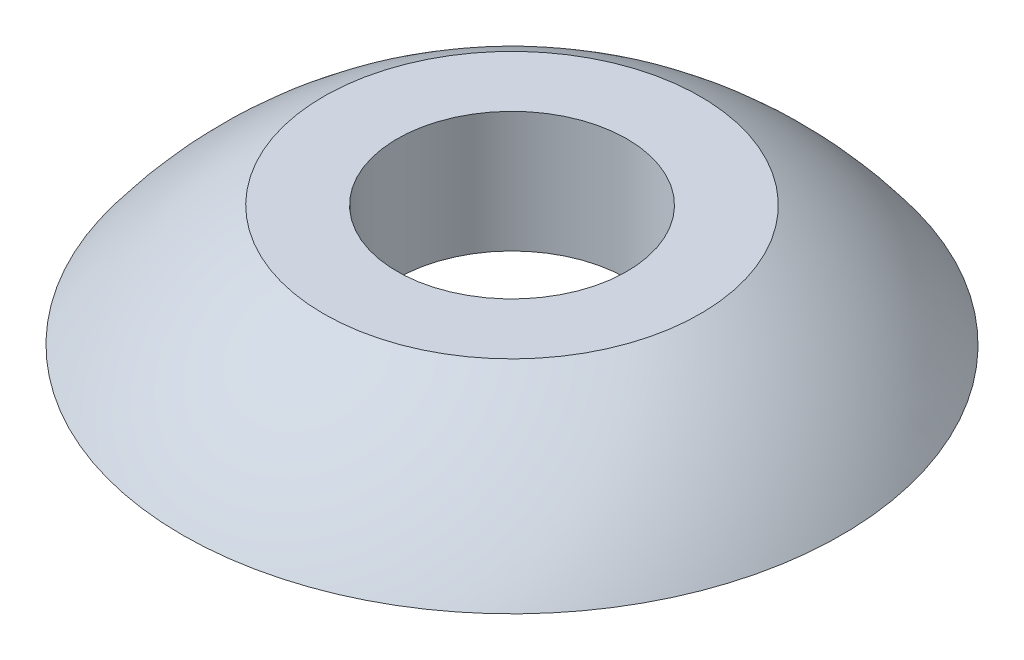
from build123d import *


with BuildPart() as part:
    # Sketch2 → Revolve1 (revolve)
    with BuildSketch(Plane(origin=(0, 0, 0), x_dir=(0, 0, -1), z_dir=(1, 0, 0))):
        with BuildLine():
            Line((-11.5, 28), (-11.5, 20))
            Line((-11.5, 20), (-9.5, 20))
            Line((-9.5, 20), (-9.5, 30))
            Line((-9.5, 30), (-10.547037499, 30))
            ThreePointArc((-10.547037499, 30), (-12.849730042, 29.088218197), (-15.074481749, 28))
            Line((-15.074481749, 28), (-11.5, 28))
        make_face()
        with BuildLine():
            ThreePointArc((-15.570484899, 30), (-21.985230431, 25.672741243), (-27.247752201, 20))
            Line((-27.247752201, 20), (-24.723268392, 20))
            ThreePointArc((-24.723268392, 20), (-20.296926592, 24.480089275), (-15.074481749, 28))
            ThreePointArc((-15.074481749, 28), (-12.849730042, 29.088218197), (-10.547037499, 30))
            Line((-10.547037499, 30), (-15.570484899, 30))
        make_face()
    revolve(axis=Axis((0, 0, 0), (0, 1, 0)))


solid = part.part
